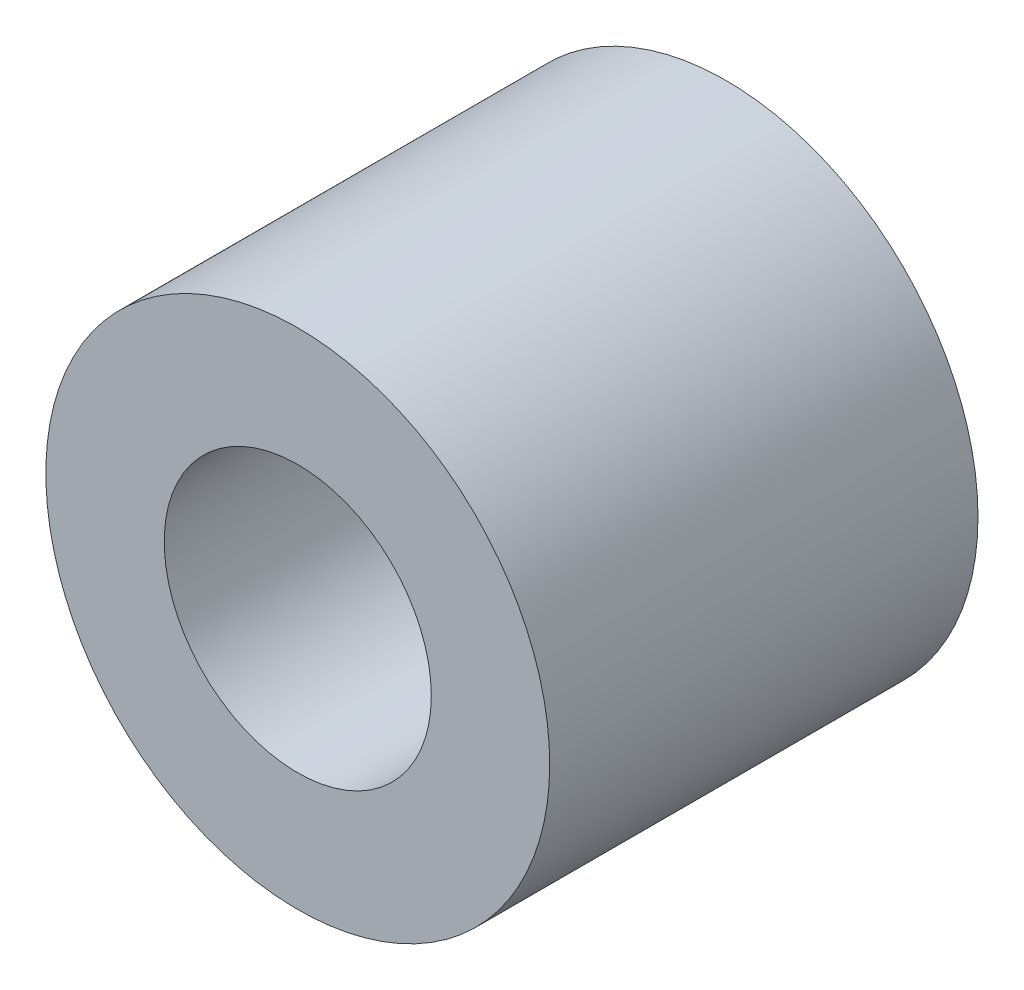
from build123d import *

# Parameters (mm, degrees)
CROQUIS1_R              = 5
CROQUIS1_R_2            = 2.65
SALIENTE_EXTRUIR1_DEPTH = 8.5


with BuildPart() as part:
    # Croquis1 → Saliente-Extruir1 (new body)
    with BuildSketch(Plane.XY):
        Circle(CROQUIS1_R)
        Circle(CROQUIS1_R_2, mode=Mode.SUBTRACT)
    extrude(amount=SALIENTE_EXTRUIR1_DEPTH)


solid = part.part
